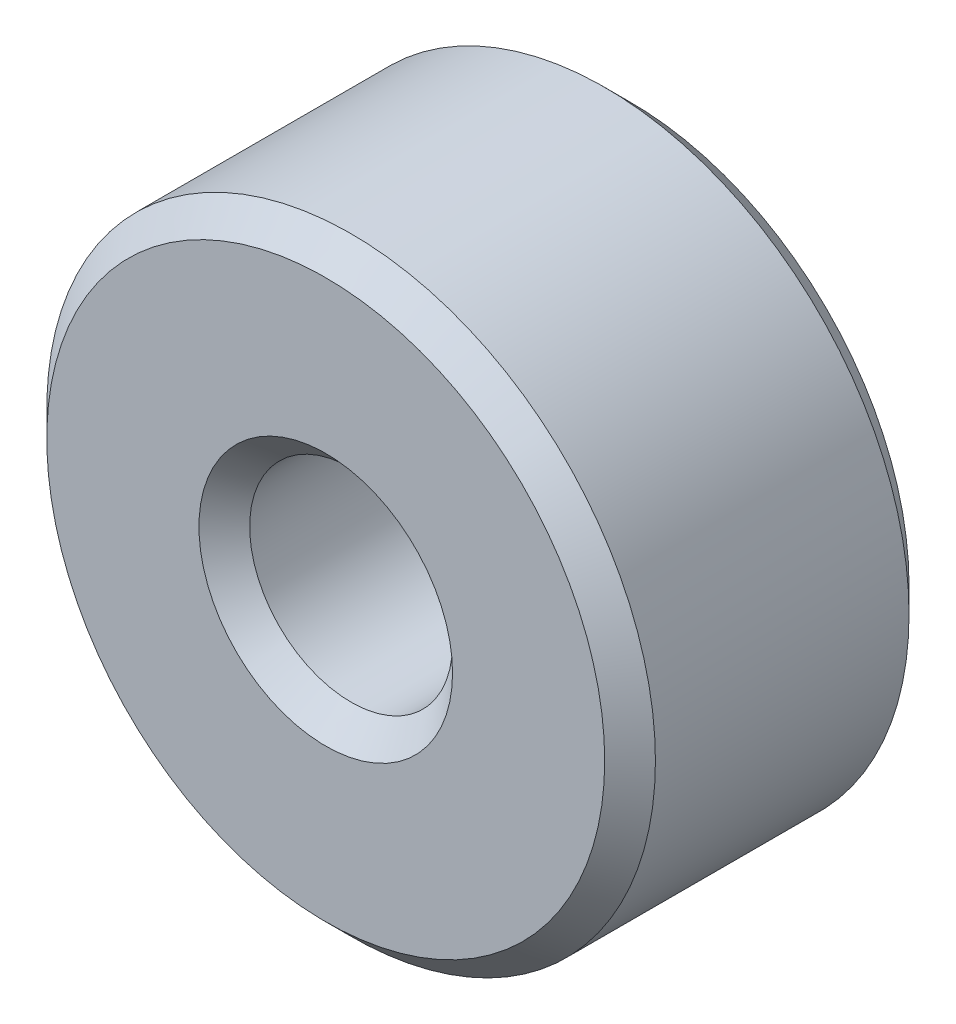
from build123d import *

# Parameters (mm, degrees)
SKETCH1_R           = 3
SKETCH1_R_2         = 1
EXTRUDE_THIN1_DEPTH = 3
CHAMFER1_SIZE       = 0.25
SCALE1_SCALE        = 0.445


with BuildPart() as part:
    # Sketch1 → Extrude-Thin1 (new body)
    with BuildSketch(Plane.XY):
        Circle(SKETCH1_R)
        Circle(SKETCH1_R_2, mode=Mode.SUBTRACT)
    extrude(amount=EXTRUDE_THIN1_DEPTH)

    # Chamfer1
    chamfer1_edges = [part.edges().sort_by_distance(p)[0] for p in [
        (-3, 0, 0),
        (-3, 0, 3),
        (-1, 0, 0),
        (-1, 0, 3),
    ]]
    chamfer(chamfer1_edges, length=CHAMFER1_SIZE)


with BuildPart() as part_1:
    # Scale1: scaled about (0, 0, 1.5)
    add(part.part.scale(SCALE1_SCALE).moved(Location((0, 0, 0.8325))))


solid = part_1.part
